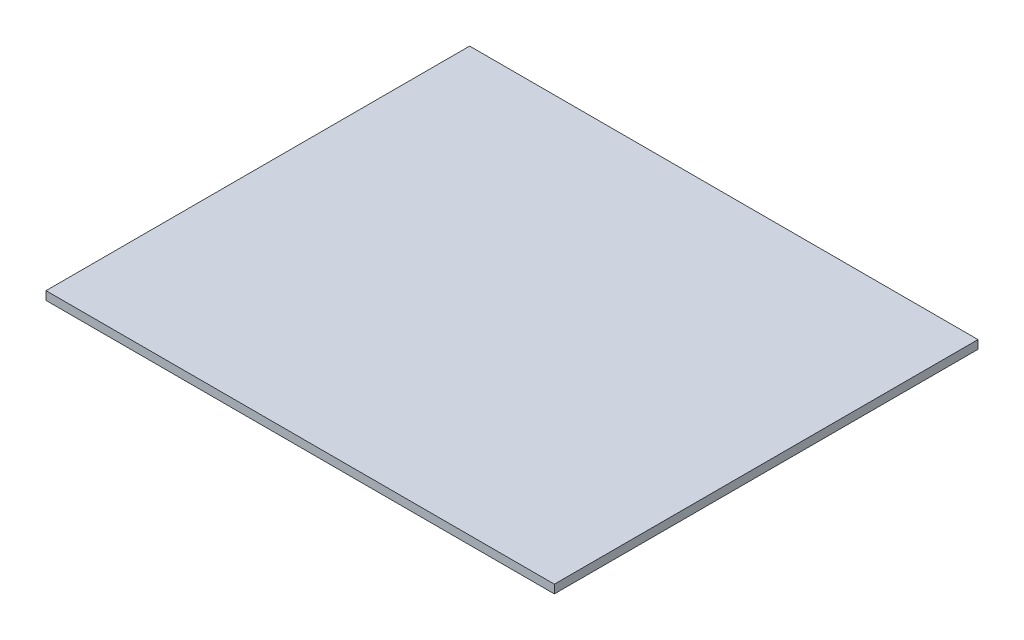
from build123d import *

# Parameters (mm, degrees)
SKETCH1_W           = 180
SKETCH1_H           = 150
BOSS_EXTRUDE1_DEPTH = 3


with BuildPart() as part:
    # Sketch1 → Boss-Extrude1 (new body)
    with BuildSketch(Plane(origin=(0, 0, 0), x_dir=(1, 0, 0), z_dir=(0, 1, 0))):
        Rectangle(SKETCH1_W, SKETCH1_H)
    extrude(amount=BOSS_EXTRUDE1_DEPTH)


solid = part.part
